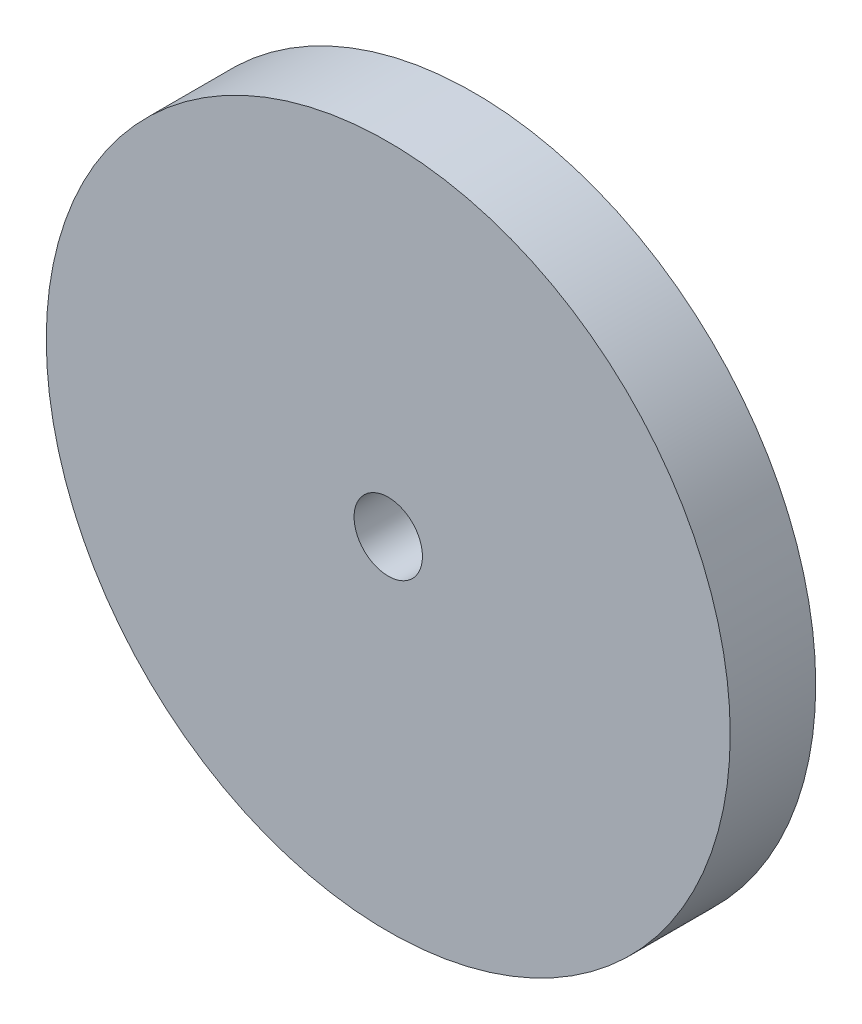
from build123d import *

# Parameters (mm, degrees)
SKETCH1_R           = 20
BOSS_EXTRUDE1_DEPTH = 2.5
SKETCH2_R           = 2
CUT_EXTRUDE1_DEPTH  = 5


with BuildPart() as part:
    # Sketch1 → Boss-Extrude1 (new, symmetric)
    with BuildSketch(Plane.XY):
        Circle(SKETCH1_R)
    extrude(amount=BOSS_EXTRUDE1_DEPTH, both=True)

    # Sketch2 → Cut-Extrude1 (cut)
    with BuildSketch(Plane.XY.offset(2.5)):
        Circle(SKETCH2_R)
    extrude(amount=-CUT_EXTRUDE1_DEPTH, mode=Mode.SUBTRACT)


solid = part.part
